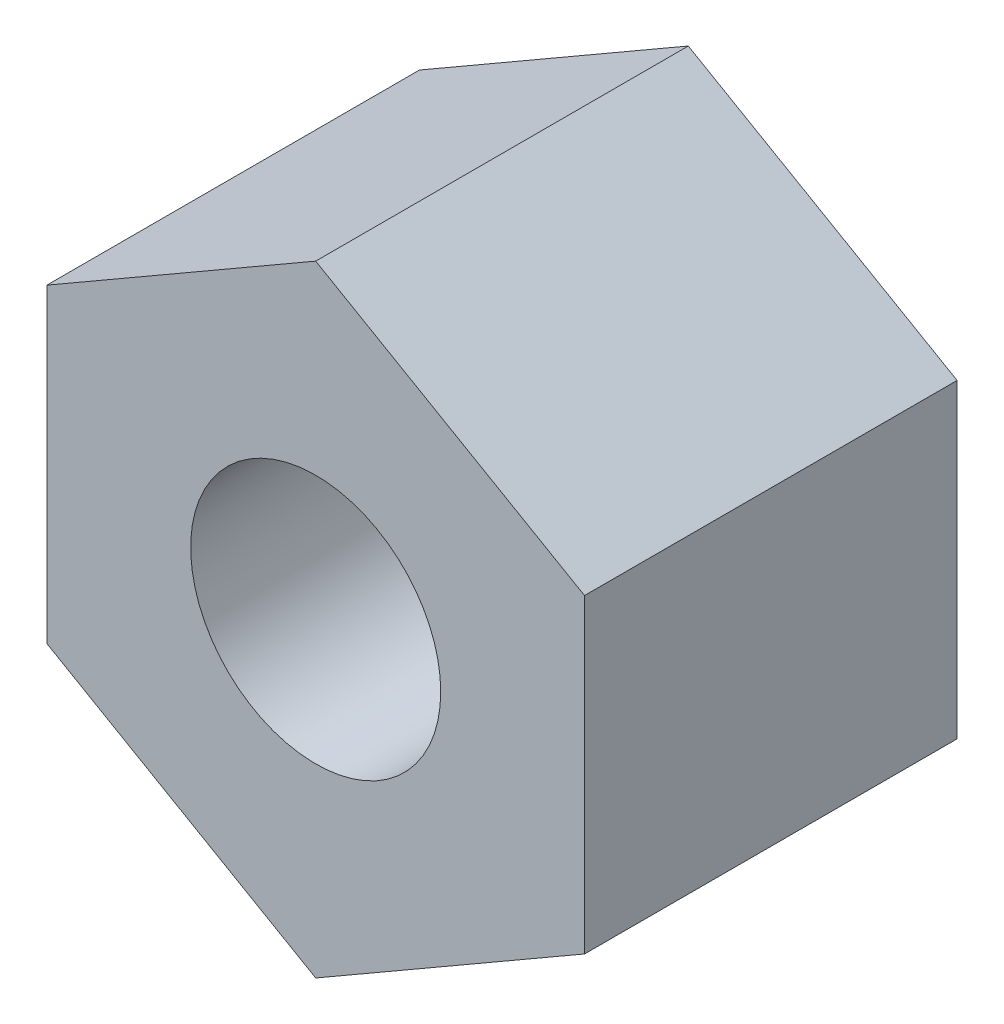
from build123d import *

# Parameters (mm, degrees)
BOSS_EXTRUDE1_DEPTH = 5.96
CUT_EXTRUDE1_REACH  = 10.869
SKETCH2_R           = 2


with BuildPart() as part:
    # Sketch1 → Boss-Extrude1 (new body)
    with BuildSketch(Plane(origin=(0, 0, 0), x_dir=(0, 1, 0), z_dir=(0, 0, 1))):
        Polygon((4.965212315, 0), (2.482606158, 4.3), (-2.482606158, 4.3), (-4.965212315, 0), (-2.482606158, -4.3), (2.482606158, -4.3), align=None)
    extrude(amount=BOSS_EXTRUDE1_DEPTH)

    # Sketch2 → Cut-Extrude1 (cut, up to next)
    with BuildSketch(Plane(origin=(0, 0, 0), x_dir=(0, 1, 0), z_dir=(0, 0, 1)), mode=Mode.PRIVATE) as cut_extrude1_sk1:
        with Locations(Location((0, 0, 0), (0, 0, 270))):
            Circle(SKETCH2_R)
    cut_extrude1_tool1 = extrude(cut_extrude1_sk1.sketch, amount=CUT_EXTRUDE1_REACH, mode=Mode.PRIVATE) & part.part
    add(cut_extrude1_tool1.solids().sort_by_distance((0, 0, 0))[0], mode=Mode.SUBTRACT)


solid = part.part
